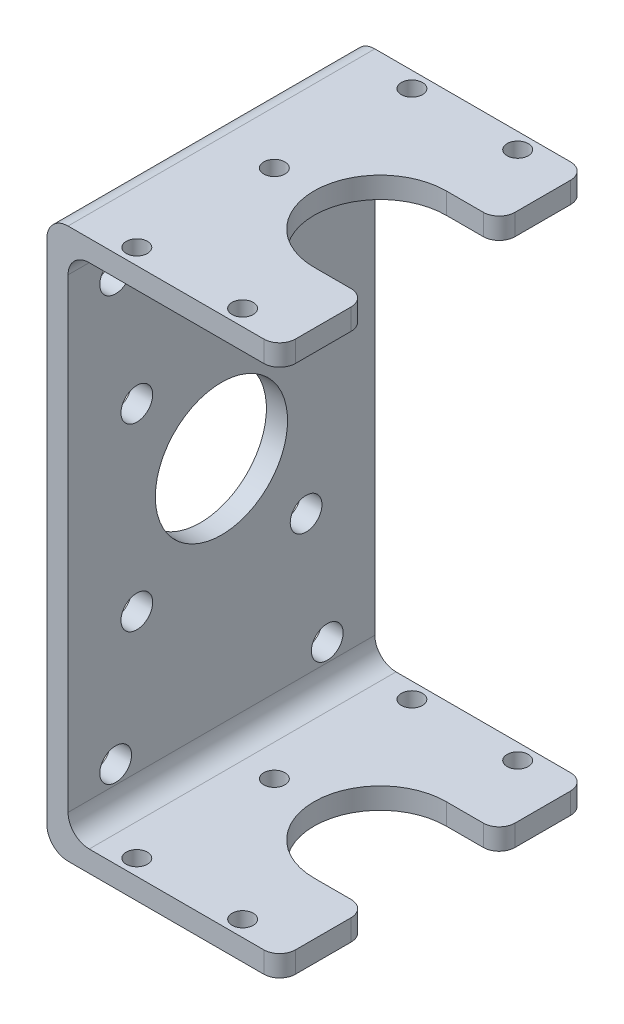
from build123d import *

# Parameters (mm, degrees)
EXTRUDE_1_DEPTH     = 14.5
SKETCH_2_R          = 1
CUT_EXTRUDE_1_DEPTH = 30
CUT_EXTRUDE_START   = -30
SKETCH_3_R          = 1
CUT_EXTRUDE_2_DEPTH = 30
FILLET_1_R          = 2
FILLET_2_R          = 1.5
SKETCH_4_R          = 6.25
SKETCH_4_R_2        = 1.5
CUT_EXTRUDE_3_DEPTH = 30


with BuildPart() as part:
    # ｽｹｯﾁ1 → ﾎﾞｽ - 押し出し1 (new, symmetric)
    with BuildSketch(Plane.XY):
        Polygon((0, 26.298850575), (0, -25.701149425), (22, -25.701149425), (22, -23.701149425), (2, -23.701149425), (2, 24.298850575), (22, 24.298850575), (22, 26.298850575), align=None)
    extrude(amount=EXTRUDE_1_DEPTH, both=True)

    # ｽｹｯﾁ2 → ｶｯﾄ - 押し出し1 (cut)
    with BuildSketch(Plane(origin=(0, 26.298850575, 0), x_dir=(1, 0, 0), z_dir=(0, 1, 0))):
        with BuildLine():
            ThreePointArc((17, 6.25), (10.75, 0), (17, -6.25))
            Line((17, -6.25), (22, -6.25))
            Line((22, -6.25), (22, 6.25))
            Line((22, 6.25), (17, 6.25))
        make_face()
        with Locations(Location((17, 13, 0), (0, 0, 270))):
            Circle(SKETCH_2_R)
        with Locations(Location((17, -13, 0), (0, 0, 270))):
            Circle(SKETCH_2_R)
        with Locations(Location((7, 0, 0), (0, 0, 270))):
            Circle(SKETCH_2_R)
        with Locations(Location((7, 13, 0), (0, 0, 270))):
            Circle(SKETCH_2_R)
        with Locations(Location((7, -13, 0), (0, 0, 270))):
            Circle(SKETCH_2_R)
    extrude(amount=-CUT_EXTRUDE_1_DEPTH, mode=Mode.SUBTRACT)

    # ｽｹｯﾁ3 → ｶｯﾄ - 押し出し2 (cut)
    with BuildSketch(Plane.XZ.offset(25.701149425).offset(CUT_EXTRUDE_START)):
        with BuildLine():
            Line((17, -6.25), (22, -6.25))
            Line((22, -6.25), (22, 6.25))
            Line((22, 6.25), (17, 6.25))
            ThreePointArc((17, 6.25), (10.75, 0), (17, -6.25))
        make_face()
        with Locations(Location((17, -13, 0), (0, 0, 90))):
            Circle(SKETCH_3_R)
        with Locations(Location((17, 13, 0), (0, 0, 90))):
            Circle(SKETCH_3_R)
        with Locations(Location((7, 0, 0), (0, 0, 90))):
            Circle(SKETCH_3_R)
        with Locations(Location((7, -13, 0), (0, 0, 90))):
            Circle(SKETCH_3_R)
        with Locations(Location((7, 13, 0), (0, 0, 90))):
            Circle(SKETCH_3_R)
    extrude(amount=CUT_EXTRUDE_2_DEPTH, mode=Mode.SUBTRACT)

    # ﾌｨﾚｯﾄ1
    fillet_1_edges = [part.edges().sort_by_distance(p)[0] for p in [
        (2, 24.298850575, 0),
        (2, -23.701149425, 0),
        (0, -25.701149425, 0),
        (0, 26.298850575, 0),
    ]]
    fillet(fillet_1_edges, radius=FILLET_1_R)

    # ﾌｨﾚｯﾄ2
    fillet_2_edges = [part.edges().sort_by_distance(p)[0] for p in [
        (22, -24.701149425, -14.5),
        (22, -24.701149425, 14.5),
        (22, 25.298850575, 6.25),
        (22, 25.298850575, -6.25),
        (22, 25.298850575, 14.5),
        (22, 25.298850575, -14.5),
        (22, -24.701149425, 6.25),
        (22, -24.701149425, -6.25),
    ]]
    fillet(fillet_2_edges, radius=FILLET_2_R)

    # ｽｹｯﾁ4 → ｶｯﾄ - 押し出し3 (cut)
    with BuildSketch(Plane.ZY):
        Circle(SKETCH_4_R)
        with Locations((10, -20)):
            Circle(SKETCH_4_R_2)
        with Locations((-10, -20)):
            Circle(SKETCH_4_R_2)
        with Locations((-10, 20)):
            Circle(SKETCH_4_R_2)
        with Locations((10, 20)):
            Circle(SKETCH_4_R_2)
        with Locations((8, -8.5)):
            Circle(SKETCH_4_R_2)
        with Locations((-8, -8.5)):
            Circle(SKETCH_4_R_2)
        with Locations((-8, 8.5)):
            Circle(SKETCH_4_R_2)
        with Locations((8, 8.5)):
            Circle(SKETCH_4_R_2)
    extrude(amount=-CUT_EXTRUDE_3_DEPTH, mode=Mode.SUBTRACT)


solid = part.part
